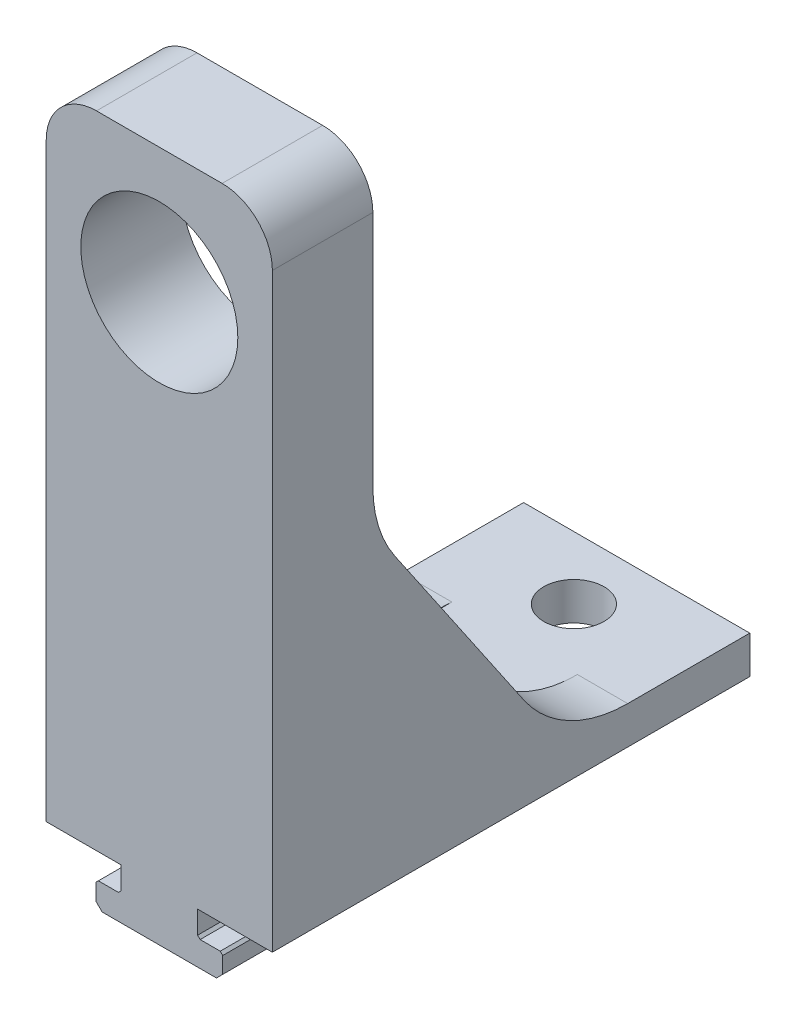
from build123d import *

# Parameters (mm, degrees)
EXTRUDE_1_DEPTH      = 4
EXTRUDE_1_DEPTH_BACK = 4
SKETCH_1_R           = 6.25
EXTRUDE_2_DEPTH      = 34
RIB_1_REACH          = 74.118
SKETCH_2_WALL_W      = 172.862971768
SKETCH_2_WALL_H      = 4
FILLET_1_R           = 10
EXTRUDE_3_DEPTH      = 22
CHAMFER_1_SIZE       = 0.2
SKETCH_4_R           = 2.4
CUT_EXTRUDE_1_DEPTH  = 60.506302187


with BuildPart() as part:
    # 草图1 → 凸台-拉伸1 (new, two sides: drawn at the far end of the back side and taken through both)
    # profile 1 of 3: a face of its own
    with BuildSketch(Plane.XY.offset(-EXTRUDE_1_DEPTH_BACK)):
        Polygon((-9, 10), (-3.05, 10), (3.05, 10), (9, 10), (9, 13), (-9, 13), align=None)
    # profile 2 of 3: a face of its own
    with BuildSketch(Plane.XY.offset(-EXTRUDE_1_DEPTH_BACK)):
        Polygon((3.05, 10), (-3.05, 10), (-3.05, 8), (-5.05, 8), (-5.05, 6.5), (-4.55, 6), (4.55, 6), (5.05, 6.5), (5.05, 8), (3.05, 8), align=None)
    # profile 3 of 3: a face of its own
    with BuildSketch(Plane.XY.offset(-EXTRUDE_1_DEPTH_BACK)):
        with BuildLine():
            Line((-9, 57), (-9, 13))
            Line((-9, 13), (9, 13))
            Line((9, 13), (9, 57))
            ThreePointArc((9, 57), (7.828427125, 59.828427125), (5, 61))
            Line((5, 61), (-5, 61))
            ThreePointArc((-5, 61), (-7.828427125, 59.828427125), (-9, 57))
        make_face()
        with Locations((0, 51)):
            Circle(SKETCH_1_R, mode=Mode.SUBTRACT)
    extrude(amount=EXTRUDE_1_DEPTH + EXTRUDE_1_DEPTH_BACK)

    # 草图1<6> → 凸台-拉伸2 (add)
    with BuildSketch(Plane.XY):
        Polygon((-9, 10), (-3.05, 10), (3.05, 10), (9, 10), (9, 13), (-9, 13), align=None)
    extrude(amount=-EXTRUDE_2_DEPTH)

    # 草图2 wall → 筋1 (add, up to next)
    with BuildSketch(Plane(origin=(9, 24, -11.5), x_dir=(0, -0.826227342808, -0.563336824642), z_dir=(0, 0.563336824642, -0.826227342808)), mode=Mode.PRIVATE) as rib_1_sk1:
        with Locations((0, 2)):
            Rectangle(SKETCH_2_WALL_W, SKETCH_2_WALL_H)
    rib_1_tool1 = extrude(rib_1_sk1.sketch, amount=-RIB_1_REACH, mode=Mode.PRIVATE) - part.part
    rib_1 = rib_1_tool1.solids().sort_by_distance((9, 24, -11.5))[0]
    add(rib_1)

    # 镜向1: 筋1 across plane
    add(rib_1.mirror(Plane(origin=(0, 0, 0), x_dir=(0, 0, 1), z_dir=(1, 0, 0))))

    # 圆角1
    fillet_1_edges = [part.edges().sort_by_distance(p)[0] for p in [
        (7, 13, -19),
        (7, 35, -4),
        (-7, 13, -19),
        (-7, 35, -4),
    ]]
    fillet(fillet_1_edges, radius=FILLET_1_R)

    # 草图1<7> → 凸台-拉伸3 (add)
    with BuildSketch(Plane.XY):
        Polygon((3.05, 8), (5.05, 8), (5.05, 6.5), (4.55, 6), (-4.55, 6), (-5.05, 6.5), (-5.05, 8), (-3.05, 8), (-3.05, 10), (3.05, 10), align=None)
    extrude(amount=-EXTRUDE_3_DEPTH)

    # 倒角1
    chamfer_1_edges = [part.edges().sort_by_distance(p)[0] for p in [
        (5.05, 8, -9),
        (-5.05, 8, -9),
        (-3.05, 8, -9),
        (3.05, 8, -9),
    ]]
    chamfer(chamfer_1_edges, length=CHAMFER_1_SIZE)

    # 草图4 → 切除-拉伸1 (cut, through all)
    with BuildSketch(Plane(origin=(0, 13, 0), x_dir=(1, 0, 0), z_dir=(0, 1, 0))):
        with Locations(Location((0, 29, 0), (0, 0, 270))):
            Circle(SKETCH_4_R)
    extrude(amount=-CUT_EXTRUDE_1_DEPTH, mode=Mode.SUBTRACT)


solid = part.part
